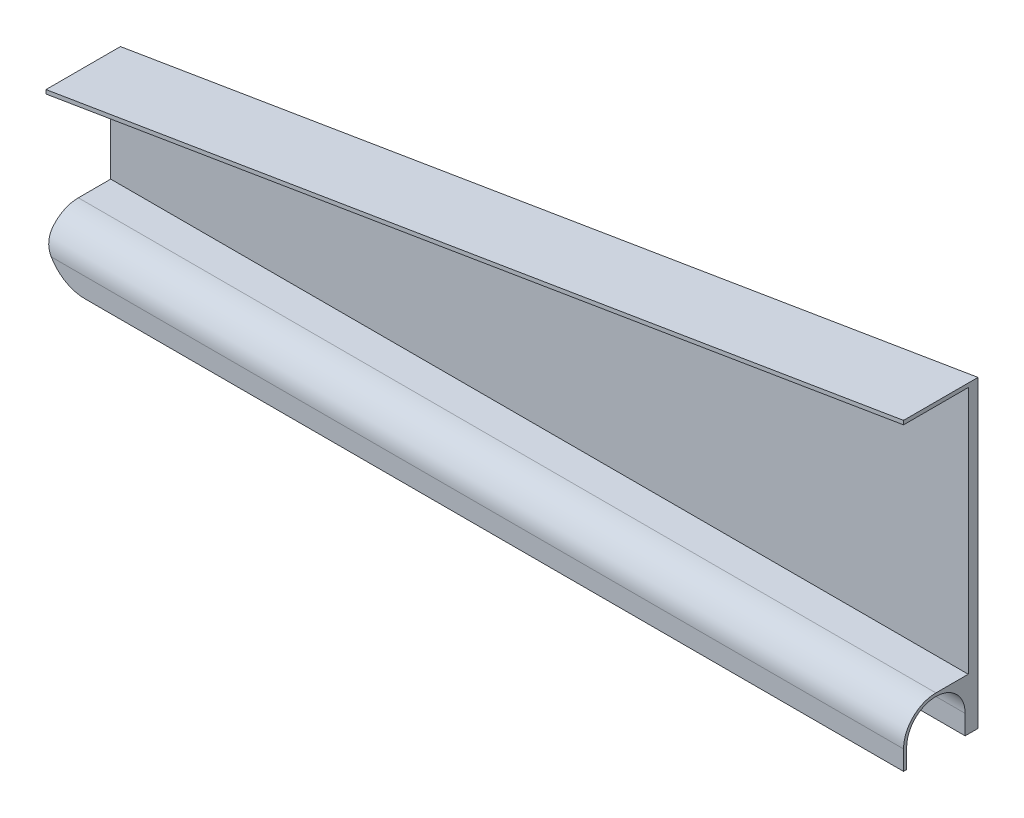
from build123d import *

# Parameters (mm, degrees)
BOSS_EXTRUDE1_DEPTH     = 6.35
BOSS_EXTRUDE7_DEPTH     = 558.8
CUT_EXTRUDE1_DEPTH      = 551.191074589
CUT_EXTRUDE1_DEPTH_BACK = 551.191074589
BOSS_EXTRUDE8_DEPTH     = 42.164
CUT_EXTRUDE2_DEPTH      = 110.49


with BuildPart() as part:
    # Sketch1 → Boss-Extrude1 (new body)
    with BuildSketch(Plane.XY):
        with BuildLine():
            Line((-508.085110878, -34.117945662), (-508.085110878, -168.737945662))
            Line((-508.085110878, -168.737945662), (-508.085110878, -181.437945662))
            ThreePointArc((-508.085110878, -181.437945662), (-500.64562312, -199.398457904), (-482.685110878, -206.837945662))
            Line((-482.685110878, -206.837945662), (50.714889122, -206.837945662))
            Line((50.714889122, -206.837945662), (50.714889122, -8.717945662))
            Line((50.714889122, -8.717945662), (-482.685110878, -8.717945662))
            ThreePointArc((-482.685110878, -8.717945662), (-500.64562312, -16.15743342), (-508.085110878, -34.117945662))
        make_face()
    extrude(amount=BOSS_EXTRUDE1_DEPTH)

    # Sketch3 → Boss-Extrude7 (add)
    with BuildSketch(Plane(origin=(50.714889122, 0, 0), x_dir=(0, 0, -1), z_dir=(1, 0, 0))):
        with BuildLine():
            Line((-6.35, -173.055945662), (-27.432, -173.055945662))
            ThreePointArc((-27.432, -173.055945662), (-42.339225161, -179.230720501), (-48.514, -194.137945662))
            Line((-48.514, -194.137945662), (-48.514, -206.837945662))
            Line((-48.514, -206.837945662), (-46.482, -206.837945662))
            Line((-46.482, -206.837945662), (-46.482, -194.137945662))
            ThreePointArc((-46.482, -194.137945662), (-27.432, -175.087945662), (-8.382, -194.137945662))
            Line((-8.382, -194.137945662), (-8.382, -206.837945662))
            Line((-8.382, -206.837945662), (-6.35, -206.837945662))
            Line((-6.35, -206.837945662), (-6.35, -173.055945662))
        make_face()
    extrude(amount=-BOSS_EXTRUDE7_DEPTH)

    # Sketch4 → Cut-Extrude1 (cut, two sides: drawn at the far end of the back side and taken through both)
    with BuildSketch(Plane.XY.offset(6.35).offset(-CUT_EXTRUDE1_DEPTH_BACK)):
        Polygon((-508.085110878, -101.427945662), (50.714889122, -8.717945662), (-523.466542696, -8.717945662), align=None)
    extrude(amount=CUT_EXTRUDE1_DEPTH + CUT_EXTRUDE1_DEPTH_BACK, mode=Mode.SUBTRACT)

    # Sketch5 → Boss-Extrude8 (add, through all)
    with BuildSketch(Plane.XY.offset(6.35)):
        Polygon((-508.085110878, -101.427945662), (50.714889122, -8.717945662), (50.714889122, -11.257945662), (-508.085110878, -103.967945662), align=None)
    extrude(amount=BOSS_EXTRUDE8_DEPTH)

    # Sketch6 → Cut-Extrude2 (cut)
    with BuildSketch(Plane(origin=(0, 0, 6.35), x_dir=(-1, 0, 0), z_dir=(0, 0, -1))):
        with BuildLine():
            Line((482.685110878, -206.837945662), (508.085110878, -206.837945662))
            Line((508.085110878, -206.837945662), (508.085110878, -181.437945662))
            ThreePointArc((508.085110878, -181.437945662), (500.64562312, -199.398457904), (482.685110878, -206.837945662))
        make_face()
    extrude(amount=-CUT_EXTRUDE2_DEPTH, mode=Mode.SUBTRACT)


solid = part.part
